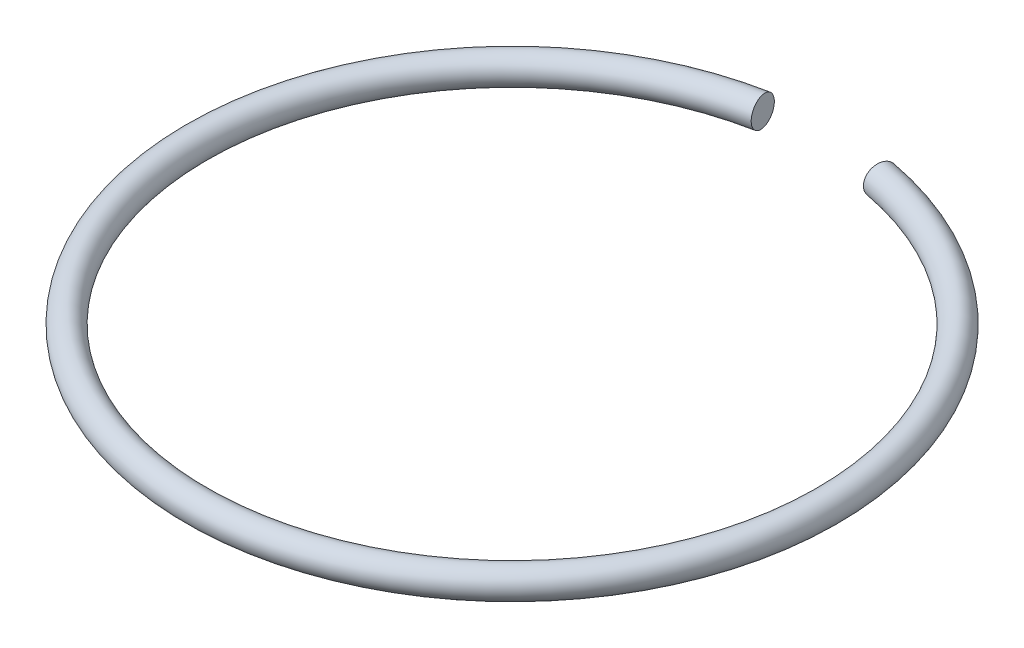
from build123d import *

# Parameters (mm, degrees)
ESBO_O1_R                  = 1.5
CORTE_EXTRUS_O1_DEPTH      = 10
CORTE_EXTRUS_O1_DEPTH_BACK = 10


with BuildPart() as part:
    # Esboço1 → Revolução1 (revolve)
    with BuildSketch(Plane.XY):
        with Locations((32.5, 5.618660022)):
            Circle(ESBO_O1_R)
    revolve(axis=Axis((0, -35.505149502, 0), (0, 1, 0)))

    # Esboço2 → Corte-extrusão1 (cut, two sides: drawn at the far end of the back side and taken through both)
    with BuildSketch(Plane(origin=(0, 0, 0), x_dir=(1, 0, 0), z_dir=(0, 1, 0)).offset(-CORTE_EXTRUS_O1_DEPTH_BACK)):
        Polygon((0, 0), (7.5, 39.472002965), (-7.5, 39.472002965), align=None)
    extrude(amount=CORTE_EXTRUS_O1_DEPTH + CORTE_EXTRUS_O1_DEPTH_BACK, mode=Mode.SUBTRACT)


solid = part.part
